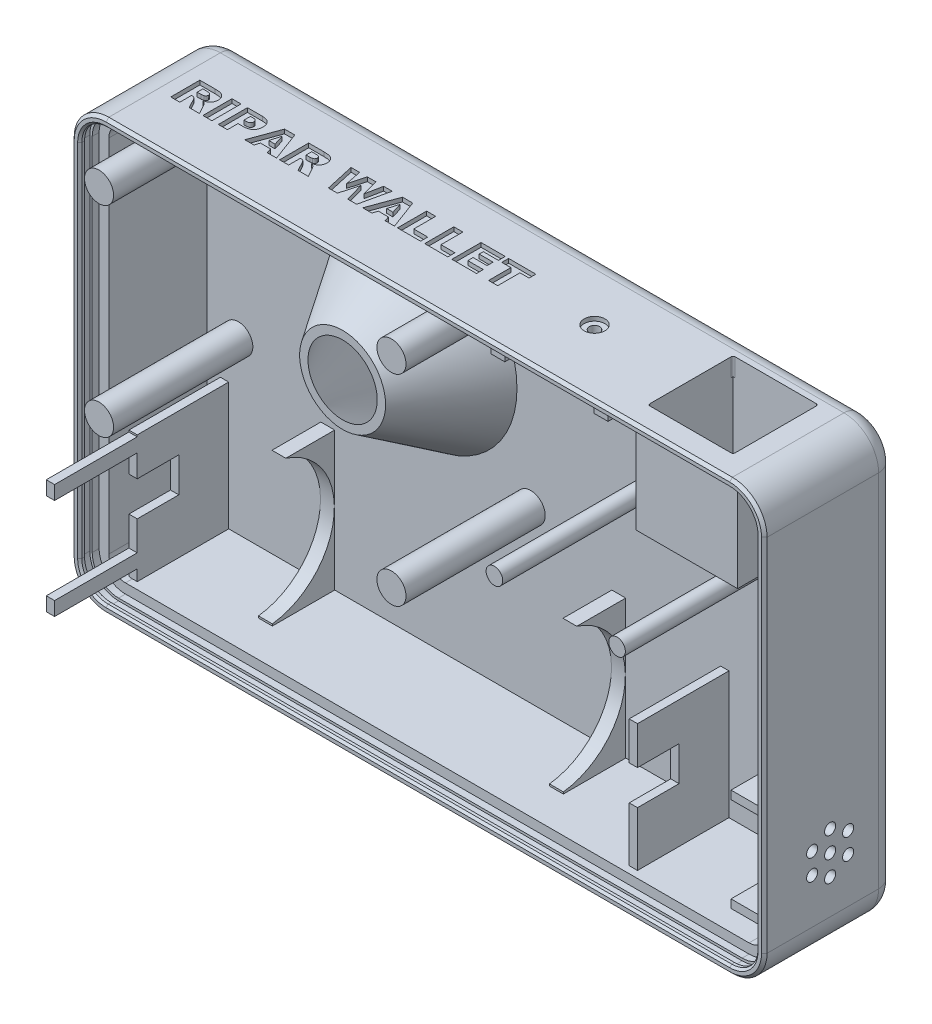
from build123d import *

# Parameters (mm, degrees)
BODY_DEPTH                 = 19
ROUND_BACK_R               = 2.5
CAVITY_DEPTH               = 17
REBATE_DEPTH               = 2.8
GROOVE_DEPTH               = 1.1
RIM_LEADIN_SIZE            = 0.3
SEAM_SHADOW_SIZE           = 0.4
BOARD_PEGS_SK5_R           = 2.1
BOARD_PEGS_DEPTH           = 20.1
CELL_SADDLES_SK6_W         = 2
CELL_SADDLES_SK6_H         = 20
CELL_SADDLES_DEPTH         = 9
CELL_STOPS_SK7_W           = 1.2
CELL_STOPS_SK7_H           = 18.35
CELL_STOPS_DEPTH           = 13.2
TP_KEEPERS_SK8_W           = 1.2
TP_KEEPERS_SK8_H           = 2
TP_KEEPERS_DEPTH           = 11.93
CELL_WIRE_SLOTS_SK9_W      = 3
CELL_WIRE_SLOTS_SK9_H      = 5
CELL_WIRE_SLOTS_DEPTH      = 6
CELL_CAVITY_SK10_R         = 10.15
CELL_CAVITY_DEPTH          = 71
LENS_HOOD_SK11_R           = 13.668187322
LENS_HOOD_DEPTH            = 11.5
LENS_HOOD_TAPER            = 33
LENS_BORE_SK12_R           = 13.767002508
LENS_BORE_DEPTH            = 13.51
LENS_BORE_TAPER            = 33
LENS_BEZEL_SK13_R          = 17
LENS_BEZEL_SK13_R_2        = 16
LENS_BEZEL_DEPTH           = 0.6
SWITCH_CRADLE_SK14_W       = 14.7
SWITCH_CRADLE_SK14_H       = 14.2
SWITCH_CRADLE_SK14_W_2     = 12.3
SWITCH_CRADLE_SK14_H_2     = 12.3
SWITCH_CRADLE_DEPTH        = 12.15
SWITCH_FLOOR_SK15_W        = 14.7
SWITCH_FLOOR_SK15_H        = 14.2
SWITCH_FLOOR_DEPTH         = 1.2
SWITCH_HOLE_DEPTH          = 2.8
MIC_RAILS_SK17_W           = 1.2
MIC_RAILS_SK17_H           = 14
MIC_RAILS_DEPTH            = 2
MIC_LIPS_SK18_W            = 1.2
MIC_LIPS_SK18_H            = 14
MIC_LIPS_DEPTH             = 0.85
MIC_HOLE_SK19_R            = 0.75
MIC_HOLE_DEPTH             = 2.8
MIC_CSK_SK20_R             = 1.5
MIC_CSK_DEPTH              = 0.6
BUZZER_CRADLE_BLOCK_SK21_W = 14.2
BUZZER_CRADLE_BLOCK_SK21_H = 14.8
BUZZER_CRADLE_BLOCK_DEPTH  = 5
BUZZER_POCKET_DEPTH        = 5.01
BUZZER_HOLES_SK23_R        = 0.8
BUZZER_HOLES_DEPTH         = 2.8
BUZZER_CHAMBER_SK24_R      = 5
BUZZER_CHAMBER_DEPTH       = 1.3
MAX_POSTS_SK25_R           = 1.2
MAX_POSTS_DEPTH            = 26.1
TXT_TOP_SK26_W             = 1.309090909
TXT_TOP_SK26_H             = 4.2
TXT_TOP_DEPTH              = 0.6
TXT_BOTTOM_SK27_W          = 1.714285714
TXT_BOTTOM_SK27_H          = 5.5
TXT_BOTTOM_DEPTH           = 0.6
TXT_BACK_SK28_W            = 1.87012987
TXT_BACK_SK28_H            = 6
TXT_BACK_DEPTH             = 0.8


with BuildPart() as part:
    # Body_Sk1 → Body (new body)
    with BuildSketch(Plane.XY.offset(-13)):
        with BuildLine():
            Line((-45, -31), (45, -31))
            ThreePointArc((45, -31), (48.535533906, -29.535533906), (50, -26))
            Line((50, -26), (50, 26))
            ThreePointArc((50, 26), (48.535533906, 29.535533906), (45, 31))
            Line((45, 31), (-45, 31))
            ThreePointArc((-45, 31), (-48.535533906, 29.535533906), (-50, 26))
            Line((-50, 26), (-50, -26))
            ThreePointArc((-50, -26), (-48.535533906, -29.535533906), (-45, -31))
        make_face()
    extrude(amount=-BODY_DEPTH)

    # Round_Back
    round_back_edges = [part.edges().sort_by_distance(p)[0] for p in [
        (48.535533906, -29.535533906, -32),
        (50, 0, -32),
        (48.535533906, 29.535533906, -32),
        (0, 31, -32),
        (-48.535533906, 29.535533906, -32),
        (-50, 0, -32),
        (-48.535533906, -29.535533906, -32),
        (0, -31, -32),
    ]]
    fillet(round_back_edges, radius=ROUND_BACK_R)

    # Cavity_Sk2 → Cavity (cut)
    with BuildSketch(Plane.XY.offset(-13)):
        with BuildLine():
            Line((-45, -28.4), (45, -28.4))
            ThreePointArc((45, -28.4), (46.697056275, -27.697056275), (47.4, -26))
            Line((47.4, -26), (47.4, 26))
            ThreePointArc((47.4, 26), (46.697056275, 27.697056275), (45, 28.4))
            Line((45, 28.4), (-45, 28.4))
            ThreePointArc((-45, 28.4), (-46.697056275, 27.697056275), (-47.4, 26))
            Line((-47.4, 26), (-47.4, -26))
            ThreePointArc((-47.4, -26), (-46.697056275, -27.697056275), (-45, -28.4))
        make_face()
    extrude(amount=-CAVITY_DEPTH, mode=Mode.SUBTRACT)

    # Rebate_Sk3 → Rebate (cut)
    with BuildSketch(Plane.XY.offset(-13)):
        with BuildLine():
            Line((-45, -29.8), (45, -29.8))
            ThreePointArc((45, -29.8), (47.687005769, -28.687005769), (48.8, -26))
            Line((48.8, -26), (48.8, 26))
            ThreePointArc((48.8, 26), (47.687005769, 28.687005769), (45, 29.8))
            Line((45, 29.8), (-45, 29.8))
            ThreePointArc((-45, 29.8), (-47.687005769, 28.687005769), (-48.8, 26))
            Line((-48.8, 26), (-48.8, -26))
            ThreePointArc((-48.8, -26), (-47.687005769, -28.687005769), (-45, -29.8))
        make_face()
        with BuildLine():
            Line((-45, -28.4), (45, -28.4))
            ThreePointArc((45, -28.4), (46.697056275, -27.697056275), (47.4, -26))
            Line((47.4, -26), (47.4, 26))
            ThreePointArc((47.4, 26), (46.697056275, 27.697056275), (45, 28.4))
            Line((45, 28.4), (-45, 28.4))
            ThreePointArc((-45, 28.4), (-46.697056275, 27.697056275), (-47.4, 26))
            Line((-47.4, 26), (-47.4, -26))
            ThreePointArc((-47.4, -26), (-46.697056275, -27.697056275), (-45, -28.4))
        make_face(mode=Mode.SUBTRACT)
    extrude(amount=-REBATE_DEPTH, mode=Mode.SUBTRACT)

    # Groove_Sk4 → Groove (cut)
    with BuildSketch(Plane.XY.offset(-13.7)):
        with BuildLine():
            Line((-45, -30.15), (45, -30.15))
            ThreePointArc((45, -30.15), (47.934493142, -28.934493142), (49.15, -26))
            Line((49.15, -26), (49.15, 26))
            ThreePointArc((49.15, 26), (47.934493142, 28.934493142), (45, 30.15))
            Line((45, 30.15), (-45, 30.15))
            ThreePointArc((-45, 30.15), (-47.934493142, 28.934493142), (-49.15, 26))
            Line((-49.15, 26), (-49.15, -26))
            ThreePointArc((-49.15, -26), (-47.934493142, -28.934493142), (-45, -30.15))
        make_face()
        with BuildLine():
            Line((-45, -29.5), (45, -29.5))
            ThreePointArc((45, -29.5), (47.474873734, -28.474873734), (48.5, -26))
            Line((48.5, -26), (48.5, 26))
            ThreePointArc((48.5, 26), (47.474873734, 28.474873734), (45, 29.5))
            Line((45, 29.5), (-45, 29.5))
            ThreePointArc((-45, 29.5), (-47.474873734, 28.474873734), (-48.5, 26))
            Line((-48.5, 26), (-48.5, -26))
            ThreePointArc((-48.5, -26), (-47.474873734, -28.474873734), (-45, -29.5))
        make_face(mode=Mode.SUBTRACT)
    extrude(amount=-GROOVE_DEPTH, mode=Mode.SUBTRACT)

    # Rim_LeadIn
    rim_leadin_edges = [part.edges().sort_by_distance(p)[0] for p in [
        (-47.687005769, -28.687005769, -13),
        (0, -29.8, -13),
        (47.687005769, -28.687005769, -13),
        (48.8, 0, -13),
        (47.687005769, 28.687005769, -13),
        (0, 29.8, -13),
        (-47.687005769, 28.687005769, -13),
        (-48.8, 0, -13),
    ]]
    chamfer(rim_leadin_edges, length=RIM_LEADIN_SIZE)

    # Seam_Shadow
    seam_shadow_edges = [part.edges().sort_by_distance(p)[0] for p in [
        (50, 0, -13),
        (48.535533906, -29.535533906, -13),
        (0, -31, -13),
        (-48.535533906, -29.535533906, -13),
        (-50, 0, -13),
        (-48.535533906, 29.535533906, -13),
        (0, 31, -13),
        (48.535533906, 29.535533906, -13),
    ]]
    chamfer(seam_shadow_edges, length=SEAM_SHADOW_SIZE)

    # Board_Pegs_Sk5 → Board_Pegs (add)
    with BuildSketch(Plane.XY.offset(-30)):
        with Locations(Location((-0.71, -3.91, 0), (0, 0, 180))):
            Circle(BOARD_PEGS_SK5_R)
        with Locations(Location((-0.71, 25.09, 0), (0, 0, 180))):
            Circle(BOARD_PEGS_SK5_R)
        with Locations(Location((-42.915, -3.91, 0), (0, 0, 180))):
            Circle(BOARD_PEGS_SK5_R)
        with Locations(Location((-42.915, 25.09, 0), (0, 0, 180))):
            Circle(BOARD_PEGS_SK5_R)
    extrude(amount=BOARD_PEGS_DEPTH)

    # Cell_Saddles_Sk6 → Cell_Saddles (add)
    with BuildSketch(Plane.XY.offset(-30)):
        with Locations((-30, -18.4)):
            Rectangle(CELL_SADDLES_SK6_W, CELL_SADDLES_SK6_H)
        with Locations((12, -18.4)):
            Rectangle(CELL_SADDLES_SK6_W, CELL_SADDLES_SK6_H)
    extrude(amount=CELL_SADDLES_DEPTH)

    # Cell_Stops_Sk7 → Cell_Stops (add)
    with BuildSketch(Plane.XY.offset(-30)):
        with Locations((-44.9, -19.225)):
            Rectangle(CELL_STOPS_SK7_W, CELL_STOPS_SK7_H)
        with Locations((27.3, -19.225)):
            Rectangle(CELL_STOPS_SK7_W, CELL_STOPS_SK7_H)
    extrude(amount=CELL_STOPS_DEPTH)

    # TP_Keepers_Sk8 → TP_Keepers (add)
    with BuildSketch(Plane.XY.offset(-16.8)):
        with Locations((-44.9, -25.8)):
            Rectangle(TP_KEEPERS_SK8_W, TP_KEEPERS_SK8_H)
        with Locations((-44.9, -11.3)):
            Rectangle(TP_KEEPERS_SK8_W, TP_KEEPERS_SK8_H)
    extrude(amount=TP_KEEPERS_DEPTH)

    # Cell_Wire_Slots_Sk9 → Cell_Wire_Slots (cut)
    with BuildSketch(Plane.XY.offset(-16.8)):
        with Locations((-44.9, -18.05)):
            Rectangle(CELL_WIRE_SLOTS_SK9_W, CELL_WIRE_SLOTS_SK9_H)
        with Locations((27.3, -18.05)):
            Rectangle(CELL_WIRE_SLOTS_SK9_W, CELL_WIRE_SLOTS_SK9_H)
    extrude(amount=-CELL_WIRE_SLOTS_DEPTH, mode=Mode.SUBTRACT)

    # Cell_Cavity_Sk10 → Cell_Cavity (cut)
    with BuildSketch(Plane(origin=(-44.3, 0, 0), x_dir=(0, 0, -1), z_dir=(1, 0, 0))):
        with Locations((19.8, -18.05)):
            Circle(CELL_CAVITY_SK10_R)
    extrude(amount=CELL_CAVITY_DEPTH, mode=Mode.SUBTRACT)

    # Lens_Hood_Sk11 → Lens_Hood (add)
    with BuildSketch(Plane.XY.offset(-30)):
        with Locations((-16.36, 9.94)):
            Circle(LENS_HOOD_SK11_R)
    extrude(amount=LENS_HOOD_DEPTH, taper=LENS_HOOD_TAPER)

    # Lens_Bore_Sk12 → Lens_Bore (cut)
    with BuildSketch(Plane.XY.offset(-32)):
        with Locations((-16.36, 9.94)):
            Circle(LENS_BORE_SK12_R)
    extrude(amount=LENS_BORE_DEPTH, taper=LENS_BORE_TAPER, mode=Mode.SUBTRACT)

    # Lens_Bezel_Sk13 → Lens_Bezel (cut)
    with BuildSketch(Plane.XY.offset(-32)):
        with Locations((-16.36, 9.94)):
            Circle(LENS_BEZEL_SK13_R)
        with Locations((-16.36, 9.94)):
            Circle(LENS_BEZEL_SK13_R_2, mode=Mode.SUBTRACT)
    extrude(amount=LENS_BEZEL_DEPTH, mode=Mode.SUBTRACT)

    # Switch_Cradle_Sk14 → Switch_Cradle (add)
    with BuildSketch(Plane(origin=(0, 28.4, 0), x_dir=(1, 0, 0), z_dir=(0, 1, 0))):
        with Locations((36, 22.9)):
            Rectangle(SWITCH_CRADLE_SK14_W, SWITCH_CRADLE_SK14_H)
        with Locations((36, 22.5)):
            Rectangle(SWITCH_CRADLE_SK14_W_2, SWITCH_CRADLE_SK14_H_2, mode=Mode.SUBTRACT)
    extrude(amount=-SWITCH_CRADLE_DEPTH)

    # Switch_Floor_Sk15 → Switch_Floor (add)
    with BuildSketch(Plane(origin=(0, 16.25, 0), x_dir=(1, 0, 0), z_dir=(0, 1, 0))):
        with Locations((36, 22.9)):
            Rectangle(SWITCH_FLOOR_SK15_W, SWITCH_FLOOR_SK15_H)
        with BuildLine():
            Line((31.25, 27.75), (40.75, 27.75))
            ThreePointArc((40.75, 27.75), (41.103553391, 27.603553391), (41.25, 27.25))
            Line((41.25, 27.25), (41.25, 17.75))
            ThreePointArc((41.25, 17.75), (41.103553391, 17.396446609), (40.75, 17.25))
            Line((40.75, 17.25), (31.25, 17.25))
            ThreePointArc((31.25, 17.25), (30.896446609, 17.396446609), (30.75, 17.75))
            Line((30.75, 17.75), (30.75, 27.25))
            ThreePointArc((30.75, 27.25), (30.896446609, 27.603553391), (31.25, 27.75))
        make_face(mode=Mode.SUBTRACT)
    extrude(amount=-SWITCH_FLOOR_DEPTH)

    # Switch_Hole_Sk16 → Switch_Hole (cut)
    with BuildSketch(Plane(origin=(0, 31, 0), x_dir=(1, 0, 0), z_dir=(0, 1, 0))):
        with BuildLine():
            Line((30.15, 28.65), (41.85, 28.65))
            ThreePointArc((41.85, 28.65), (42.062132034, 28.562132034), (42.15, 28.35))
            Line((42.15, 28.35), (42.15, 16.65))
            ThreePointArc((42.15, 16.65), (42.062132034, 16.437867966), (41.85, 16.35))
            Line((41.85, 16.35), (30.15, 16.35))
            ThreePointArc((30.15, 16.35), (29.937867966, 16.437867966), (29.85, 16.65))
            Line((29.85, 16.65), (29.85, 28.35))
            ThreePointArc((29.85, 28.35), (29.937867966, 28.562132034), (30.15, 28.65))
        make_face()
    extrude(amount=-SWITCH_HOLE_DEPTH, mode=Mode.SUBTRACT)

    # Mic_Rails_Sk17 → Mic_Rails (add)
    with BuildSketch(Plane(origin=(0, 28.4, 0), x_dir=(1, 0, 0), z_dir=(0, 1, 0))):
        with Locations((8.15, 23)):
            Rectangle(MIC_RAILS_SK17_W, MIC_RAILS_SK17_H)
        with Locations((23.85, 23)):
            Rectangle(MIC_RAILS_SK17_W, MIC_RAILS_SK17_H)
    extrude(amount=-MIC_RAILS_DEPTH)

    # Mic_Lips_Sk18 → Mic_Lips (add)
    with BuildSketch(Plane(origin=(0, 27.25, 0), x_dir=(1, 0, 0), z_dir=(0, 1, 0))):
        with Locations((8.95, 23)):
            Rectangle(MIC_LIPS_SK18_W, MIC_LIPS_SK18_H)
        with Locations((23.05, 23)):
            Rectangle(MIC_LIPS_SK18_W, MIC_LIPS_SK18_H)
    extrude(amount=-MIC_LIPS_DEPTH)

    # Mic_Hole_Sk19 → Mic_Hole (cut)
    with BuildSketch(Plane(origin=(0, 31, 0), x_dir=(1, 0, 0), z_dir=(0, 1, 0))):
        with Locations(Location((16, 22.5, 0), (0, 0, 270))):
            Circle(MIC_HOLE_SK19_R)
    extrude(amount=-MIC_HOLE_DEPTH, mode=Mode.SUBTRACT)

    # Mic_Csk_Sk20 → Mic_Csk (cut)
    with BuildSketch(Plane(origin=(0, 31, 0), x_dir=(1, 0, 0), z_dir=(0, 1, 0))):
        with Locations(Location((16, 22.5, 0), (0, 0, 270))):
            Circle(MIC_CSK_SK20_R)
    extrude(amount=-MIC_CSK_DEPTH, mode=Mode.SUBTRACT)

    # Buzzer_Cradle_Block_Sk21 → Buzzer_Cradle_Block (add)
    with BuildSketch(Plane(origin=(47.4, 0, 0), x_dir=(0, 0, -1), z_dir=(1, 0, 0))):
        with Locations((22.9, -18)):
            Rectangle(BUZZER_CRADLE_BLOCK_SK21_W, BUZZER_CRADLE_BLOCK_SK21_H)
    extrude(amount=-BUZZER_CRADLE_BLOCK_DEPTH)

    # Buzzer_Pocket_Sk22 → Buzzer_Pocket (cut)
    with BuildSketch(Plane(origin=(47.41, 0, 0), x_dir=(0, 0, -1), z_dir=(1, 0, 0))):
        with BuildLine():
            Line((13.5, -24.2), (22.5, -24.2))
            ThreePointArc((22.5, -24.2), (28.7, -18), (22.5, -11.8))
            Line((22.5, -11.8), (13.5, -11.8))
            Line((13.5, -11.8), (13.5, -24.2))
        make_face()
    extrude(amount=-BUZZER_POCKET_DEPTH, mode=Mode.SUBTRACT)

    # Buzzer_Holes_Sk23 → Buzzer_Holes (cut)
    with BuildSketch(Plane(origin=(50, 0, 0), x_dir=(0, 0, -1), z_dir=(1, 0, 0))):
        with Locations((22.5, -18)):
            Circle(BUZZER_HOLES_SK23_R)
        with Locations((22.5, -15)):
            Circle(BUZZER_HOLES_SK23_R)
        with Locations((19.901923789, -16.5)):
            Circle(BUZZER_HOLES_SK23_R)
        with Locations((19.901923789, -19.5)):
            Circle(BUZZER_HOLES_SK23_R)
        with Locations((22.5, -21)):
            Circle(BUZZER_HOLES_SK23_R)
        with Locations((25.098076211, -19.5)):
            Circle(BUZZER_HOLES_SK23_R)
        with Locations((25.098076211, -16.5)):
            Circle(BUZZER_HOLES_SK23_R)
    extrude(amount=-BUZZER_HOLES_DEPTH, mode=Mode.SUBTRACT)

    # Buzzer_Chamber_Sk24 → Buzzer_Chamber (cut)
    with BuildSketch(Plane(origin=(47.4, 0, 0), x_dir=(0, 0, -1), z_dir=(1, 0, 0))):
        with Locations((22.5, -18)):
            Circle(BUZZER_CHAMBER_SK24_R)
    extrude(amount=BUZZER_CHAMBER_DEPTH, mode=Mode.SUBTRACT)

    # MAX_Posts_Sk25 → MAX_Posts (add)
    with BuildSketch(Plane.XY.offset(-30)):
        with Locations((20.15, 11)):
            Circle(MAX_POSTS_SK25_R)
        with Locations((37.85, 11)):
            Circle(MAX_POSTS_SK25_R)
    extrude(amount=MAX_POSTS_DEPTH)

    # Txt_Top_Sk26 → Txt_Top (cut)
    # profile 1 of 11: a face of its own
    with BuildSketch(Plane(origin=(0, 31, 0), x_dir=(1, 0, 0), z_dir=(0, 1, 0))):
        with BuildLine():
            Line((-43.063636364, 20.4), (-43.063636364, 24.6))
            Line((-43.063636364, 24.6), (-40.884375, 24.6))
            add(Edge.make_bspline(
                [(-40.884375, 24.6), (-40.835221519, 24.59971639), (-40.740011441, 24.599167039), (-40.601919347, 24.593720803), (-40.472869492, 24.586360804), (-40.352532912, 24.57571362), (-40.241173106, 24.560145388), (-40.138829186, 24.542330308), (-40.045197391, 24.52254548), (-39.96007143, 24.497117462), (-39.88045143, 24.469318863), (-39.805945745, 24.435124965), (-39.73581699, 24.394306162), (-39.668531202, 24.349879627), (-39.60579359, 24.298760032), (-39.5467318, 24.2426364), (-39.49242178, 24.179893259), (-39.44130358, 24.113005035), (-39.395101153, 24.041348631), (-39.355041252, 23.96516429), (-39.320733022, 23.885182272), (-39.29397553, 23.801040128), (-39.271167754, 23.713889004), (-39.256032978, 23.622327282), (-39.247800087, 23.526857352), (-39.246244614, 23.461947046), (-39.245454545, 23.428977273)],
                knots=[0, 0, 0, 0, 1.530161939, 2.963916964, 4.301772633, 5.554104584, 6.723590755, 7.801032641, 8.78815049, 9.700526589, 10.564961228, 11.411843923, 12.247756654, 13.089125762, 13.919263632, 14.763741457, 15.622365315, 16.499733513, 17.382922017, 18.273079804, 19.176582198, 20.088357964, 21.01932039, 21.978954871, 22.973454249, 24, 24, 24, 24], degree=3))
            add(Edge.make_bspline(
                [(-39.245454545, 23.428977273), (-39.247073208, 23.372591064), (-39.250227218, 23.262720891), (-39.279947421, 23.104227876), (-39.327520899, 22.957031296), (-39.395508901, 22.822901534), (-39.479851155, 22.700983267), (-39.578759049, 22.591190435), (-39.691814619, 22.492640875), (-39.77679289, 22.438711734), (-39.819886364, 22.411363636)],
                knots=[0, 0, 0, 0, 1.101993432, 2.147266335, 3.141901439, 4.118584363, 5.077365473, 6.033582582, 7.002806774, 8, 8, 8, 8], degree=3))
            add(Edge.make_bspline(
                [(-39.819886364, 22.411363636), (-39.850581905, 22.394892427), (-39.915884444, 22.359851123), (-40.025609091, 22.316248363), (-40.151246892, 22.277548828), (-40.240777869, 22.255758633), (-40.287784091, 22.244318182)],
                knots=[0, 0, 0, 0, 0.837915425, 1.782604315, 2.835806388, 4, 4, 4, 4], degree=3))
            add(Edge.make_bspline(
                [(-40.287784091, 22.244318182), (-40.251832385, 22.231658258), (-40.184663787, 22.208005713), (-40.092812099, 22.168861645), (-40.016471383, 22.129493898), (-39.972789612, 22.100080372), (-39.952840909, 22.086647727)],
                knots=[0, 0, 0, 0, 1.231012792, 2.299902127, 3.223594947, 4, 4, 4, 4], degree=3))
            add(Edge.make_bspline(
                [(-39.952840909, 22.086647727), (-39.939565416, 22.075796548), (-39.908700181, 22.050567791), (-39.861729187, 22.001156793), (-39.806648361, 21.937174458), (-39.746963417, 21.862245826), (-39.68757278, 21.785660348), (-39.636457776, 21.714465941), (-39.596491976, 21.653218147), (-39.575915633, 21.614616694), (-39.566761364, 21.597443182)],
                knots=[0, 0, 0, 0, 0.656872418, 1.527214186, 2.608218659, 3.894218048, 5.199173982, 6.323536816, 7.254153438, 8, 8, 8, 8], degree=3))
            Line((-39.566761364, 21.597443182), (-38.918181818, 20.4))
            Line((-38.918181818, 20.4), (-40.395170455, 20.4))
            Line((-40.395170455, 20.4), (-41.085511364, 21.673295455))
            add(Edge.make_bspline(
                [(-41.085511364, 21.673295455), (-41.106256099, 21.71114547), (-41.144547401, 21.781010253), (-41.205224007, 21.87234537), (-41.260630898, 21.944610116), (-41.302279492, 21.979249633), (-41.320738636, 21.994602273)],
                knots=[0, 0, 0, 0, 1.29093653, 2.38285239, 3.283261246, 4, 4, 4, 4], degree=3))
            add(Edge.make_bspline(
                [(-41.320738636, 21.994602273), (-41.344494941, 22.009270374), (-41.391947009, 22.038569195), (-41.470228028, 22.069123437), (-41.553390351, 22.087667577), (-41.61041288, 22.089814418), (-41.639488636, 22.090909091)],
                knots=[0, 0, 0, 0, 0.98982165, 1.977120801, 2.968535002, 4, 4, 4, 4], degree=3))
            Line((-41.639488636, 22.090909091), (-41.754545455, 22.090909091))
            Line((-41.754545455, 22.090909091), (-41.754545455, 20.4))
            Line((-41.754545455, 20.4), (-43.063636364, 20.4))
        make_face()
        with BuildLine():
            Line((-41.754545455, 22.909090909), (-41.199715909, 22.909090909))
            add(Edge.make_bspline(
                [(-41.199715909, 22.909090909), (-41.181226216, 22.909966234), (-41.136957612, 22.912061964), (-41.060263363, 22.923576393), (-40.962497763, 22.94049139), (-40.890581174, 22.955438289), (-40.851136364, 22.963636364)],
                knots=[0, 0, 0, 0, 0.628542805, 1.504876911, 2.631474917, 4, 4, 4, 4], degree=3))
            add(Edge.make_bspline(
                [(-40.851136364, 22.963636364), (-40.830135956, 22.968534503), (-40.788534834, 22.978237556), (-40.731410221, 23.006309554), (-40.679644997, 23.042629926), (-40.635818857, 23.08865507), (-40.600142794, 23.141537496), (-40.573375918, 23.198618343), (-40.5573147, 23.259932111), (-40.555480812, 23.301893457), (-40.554545455, 23.323295455)],
                knots=[0, 0, 0, 0, 1.020158048, 2.02089986, 2.99701443, 4.007421106, 5.016748479, 6.011755855, 6.985914375, 8, 8, 8, 8], degree=3))
            add(Edge.make_bspline(
                [(-40.554545455, 23.323295455), (-40.556166489, 23.354124324), (-40.559253417, 23.41283158), (-40.583108938, 23.496113887), (-40.626449586, 23.566543737), (-40.674806347, 23.615956096), (-40.722373965, 23.649064342), (-40.766483661, 23.67011424), (-40.81747843, 23.687610036), (-40.875700716, 23.702006225), (-40.940532382, 23.714036947), (-41.012956461, 23.720990899), (-41.092245051, 23.726504066), (-41.147715378, 23.727008899), (-41.176704545, 23.727272727)],
                knots=[0, 0, 0, 0, 1.307875681, 2.490580844, 3.632121613, 4.783239074, 5.398689137, 6.08357963, 6.850117088, 7.683629419, 8.627346907, 9.646048077, 10.76980885, 12, 12, 12, 12], degree=3))
            Line((-41.176704545, 23.727272727), (-41.754545455, 23.727272727))
            Line((-41.754545455, 23.727272727), (-41.754545455, 22.909090909))
        make_face(mode=Mode.SUBTRACT)
    # profile 2 of 11: a face of its own
    with BuildSketch(Plane(origin=(0, 31, 0), x_dir=(1, 0, 0), z_dir=(0, 1, 0))):
        with Locations((-37.772727273, 22.5)):
            Rectangle(TXT_TOP_SK26_W, TXT_TOP_SK26_H)
    # profile 3 of 11: a face of its own
    with BuildSketch(Plane(origin=(0, 31, 0), x_dir=(1, 0, 0), z_dir=(0, 1, 0))):
        with BuildLine():
            Line((-36.190909091, 24.6), (-34.044886364, 24.6))
            add(Edge.make_bspline(
                [(-34.044886364, 24.6), (-33.988310973, 24.599148604), (-33.878322334, 24.597493398), (-33.719070297, 24.581020382), (-33.570598986, 24.554741379), (-33.433024274, 24.518808526), (-33.306515769, 24.470675941), (-33.191077833, 24.412178028), (-33.086923126, 24.342300919), (-32.993266201, 24.262889438), (-32.91136929, 24.172835622), (-32.839953132, 24.073866004), (-32.779417433, 23.96607674), (-32.729429179, 23.849368713), (-32.692436782, 23.723014815), (-32.665561444, 23.588116352), (-32.647718315, 23.444507435), (-32.646221939, 23.345794099), (-32.645454545, 23.295170455)],
                knots=[0, 0, 0, 0, 1.241515469, 2.413639488, 3.509639858, 4.548817243, 5.52976409, 6.475202948, 7.383211966, 8.276715391, 9.16390762, 10.048312173, 10.950197757, 11.872189062, 12.829054998, 13.834337622, 14.889372722, 16, 16, 16, 16], degree=3))
            add(Edge.make_bspline(
                [(-32.645454545, 23.295170455), (-32.646494823, 23.242835005), (-32.648519654, 23.140967485), (-32.667271764, 22.992818048), (-32.695086311, 22.853145537), (-32.737935009, 22.722820737), (-32.789884584, 22.600026469), (-32.856583235, 22.487192798), (-32.9332349, 22.382257181), (-33.022778846, 22.287300579), (-33.12342841, 22.201157765), (-33.23816983, 22.127742446), (-33.364979888, 22.065646045), (-33.503709402, 22.014376583), (-33.65511866, 21.975406563), (-33.818782788, 21.947880726), (-33.99480302, 21.930603077), (-34.116151687, 21.928405387), (-34.178693182, 21.927272727)],
                knots=[0, 0, 0, 0, 1.070678102, 2.0840047, 3.052199674, 3.98082326, 4.887114164, 5.775697953, 6.657233547, 7.54169838, 8.441079866, 9.362025723, 10.321591586, 11.326104587, 12.383868031, 13.516659844, 14.720119404, 16, 16, 16, 16], degree=3))
            Line((-34.178693182, 21.927272727), (-34.881818182, 21.927272727))
            Line((-34.881818182, 21.927272727), (-34.881818182, 20.4))
            Line((-34.881818182, 20.4), (-36.190909091, 20.4))
            Line((-36.190909091, 20.4), (-36.190909091, 24.6))
        make_face()
        with BuildLine():
            Line((-34.881818182, 22.8), (-34.586079545, 22.8))
            add(Edge.make_bspline(
                [(-34.586079545, 22.8), (-34.557942888, 22.800233895), (-34.50387213, 22.800683376), (-34.426157716, 22.806666728), (-34.35491184, 22.81666804), (-34.290303797, 22.831194239), (-34.231840471, 22.848645504), (-34.180092796, 22.870991842), (-34.134749132, 22.897194386), (-34.083703822, 22.937072053), (-34.031628381, 22.99503796), (-33.986428155, 23.075027429), (-33.958749811, 23.164408623), (-33.955975629, 23.227070764), (-33.954545455, 23.259375)],
                knots=[0, 0, 0, 0, 1.140602214, 2.191917338, 3.157925331, 4.054994258, 4.874779576, 5.628012439, 6.335275679, 6.991953112, 8.247986947, 9.465288326, 10.693279177, 12, 12, 12, 12], degree=3))
            add(Edge.make_bspline(
                [(-33.954545455, 23.259375), (-33.955887688, 23.291067589), (-33.958489984, 23.352512572), (-33.982587738, 23.440716897), (-34.021356764, 23.521210639), (-34.066511246, 23.581498991), (-34.110880853, 23.625046227), (-34.153092379, 23.652002347), (-34.20054641, 23.676149133), (-34.255546343, 23.694468913), (-34.316402943, 23.710057058), (-34.384725598, 23.71948655), (-34.459212338, 23.726896215), (-34.511341407, 23.727144222), (-34.538352273, 23.727272727)],
                knots=[0, 0, 0, 0, 1.331134553, 2.580778166, 3.815700635, 5.070763247, 5.730238369, 6.419791528, 7.168166279, 7.965798043, 8.852899023, 9.808015955, 10.864215547, 12, 12, 12, 12], degree=3))
            Line((-34.538352273, 23.727272727), (-34.881818182, 23.727272727))
            Line((-34.881818182, 23.727272727), (-34.881818182, 22.8))
        make_face(mode=Mode.SUBTRACT)
    # profile 4 of 11: a face of its own
    with BuildSketch(Plane(origin=(0, 31, 0), x_dir=(1, 0, 0), z_dir=(0, 1, 0))):
        Polygon((-29.368465909, 21.109090909), (-30.830965909, 21.109090909), (-31.043181818, 20.4), (-32.372727273, 20.4), (-30.833522727, 24.6), (-29.356534091, 24.6), (-27.790909091, 20.4), (-29.15625, 20.4), align=None)
        Polygon((-29.646306818, 22.036363636), (-30.109090909, 23.526136364), (-30.553977273, 22.036363636), align=None, mode=Mode.SUBTRACT)
    # profile 5 of 11: a face of its own
    with BuildSketch(Plane(origin=(0, 31, 0), x_dir=(1, 0, 0), z_dir=(0, 1, 0))):
        with BuildLine():
            Line((-27.354545455, 20.4), (-27.354545455, 24.6))
            Line((-27.354545455, 24.6), (-25.175284091, 24.6))
            add(Edge.make_bspline(
                [(-25.175284091, 24.6), (-25.12613061, 24.59971639), (-25.030920532, 24.599167039), (-24.892828438, 24.593720803), (-24.763778583, 24.586360804), (-24.643442003, 24.57571362), (-24.532082197, 24.560145388), (-24.429738277, 24.542330308), (-24.336106482, 24.52254548), (-24.250980521, 24.497117462), (-24.171360521, 24.469318863), (-24.096854835, 24.435124965), (-24.026726081, 24.394306162), (-23.959440293, 24.349879627), (-23.896702681, 24.298760032), (-23.837640891, 24.2426364), (-23.783330871, 24.179893259), (-23.732212671, 24.113005035), (-23.686010244, 24.041348631), (-23.645950343, 23.96516429), (-23.611642112, 23.885182272), (-23.584884621, 23.801040128), (-23.562076845, 23.713889004), (-23.546942069, 23.622327282), (-23.538709178, 23.526857352), (-23.537153705, 23.461947046), (-23.536363636, 23.428977273)],
                knots=[0, 0, 0, 0, 1.530161939, 2.963916964, 4.301772633, 5.554104584, 6.723590755, 7.801032641, 8.78815049, 9.700526589, 10.564961228, 11.411843923, 12.247756654, 13.089125762, 13.919263632, 14.763741457, 15.622365315, 16.499733513, 17.382922017, 18.273079804, 19.176582198, 20.088357964, 21.01932039, 21.978954871, 22.973454249, 24, 24, 24, 24], degree=3))
            add(Edge.make_bspline(
                [(-23.536363636, 23.428977273), (-23.537982299, 23.372591064), (-23.541136309, 23.262720891), (-23.570856511, 23.104227876), (-23.61842999, 22.957031296), (-23.686417992, 22.822901534), (-23.770760245, 22.700983267), (-23.86966814, 22.591190435), (-23.98272371, 22.492640875), (-24.067701981, 22.438711734), (-24.110795455, 22.411363636)],
                knots=[0, 0, 0, 0, 1.101993432, 2.147266335, 3.141901439, 4.118584363, 5.077365473, 6.033582582, 7.002806774, 8, 8, 8, 8], degree=3))
            add(Edge.make_bspline(
                [(-24.110795455, 22.411363636), (-24.141490996, 22.394892427), (-24.206793535, 22.359851123), (-24.316518182, 22.316248363), (-24.442155983, 22.277548828), (-24.53168696, 22.255758633), (-24.578693182, 22.244318182)],
                knots=[0, 0, 0, 0, 0.837915425, 1.782604315, 2.835806388, 4, 4, 4, 4], degree=3))
            add(Edge.make_bspline(
                [(-24.578693182, 22.244318182), (-24.542741476, 22.231658258), (-24.475572877, 22.208005713), (-24.38372119, 22.168861645), (-24.307380474, 22.129493898), (-24.263698703, 22.100080372), (-24.24375, 22.086647727)],
                knots=[0, 0, 0, 0, 1.231012792, 2.299902127, 3.223594947, 4, 4, 4, 4], degree=3))
            add(Edge.make_bspline(
                [(-24.24375, 22.086647727), (-24.230474507, 22.075796548), (-24.199609272, 22.050567791), (-24.152638278, 22.001156793), (-24.097557452, 21.937174458), (-24.037872508, 21.862245826), (-23.978481871, 21.785660348), (-23.927366867, 21.714465941), (-23.887401067, 21.653218147), (-23.866824724, 21.614616694), (-23.857670455, 21.597443182)],
                knots=[0, 0, 0, 0, 0.656872418, 1.527214186, 2.608218659, 3.894218048, 5.199173982, 6.323536816, 7.254153438, 8, 8, 8, 8], degree=3))
            Line((-23.857670455, 21.597443182), (-23.209090909, 20.4))
            Line((-23.209090909, 20.4), (-24.686079545, 20.4))
            Line((-24.686079545, 20.4), (-25.376420455, 21.673295455))
            add(Edge.make_bspline(
                [(-25.376420455, 21.673295455), (-25.39716519, 21.71114547), (-25.435456492, 21.781010253), (-25.496133098, 21.87234537), (-25.551539989, 21.944610116), (-25.593188583, 21.979249633), (-25.611647727, 21.994602273)],
                knots=[0, 0, 0, 0, 1.29093653, 2.38285239, 3.283261246, 4, 4, 4, 4], degree=3))
            add(Edge.make_bspline(
                [(-25.611647727, 21.994602273), (-25.635404032, 22.009270374), (-25.6828561, 22.038569195), (-25.761137119, 22.069123437), (-25.844299442, 22.087667577), (-25.901321971, 22.089814418), (-25.930397727, 22.090909091)],
                knots=[0, 0, 0, 0, 0.98982165, 1.977120801, 2.968535002, 4, 4, 4, 4], degree=3))
            Line((-25.930397727, 22.090909091), (-26.045454545, 22.090909091))
            Line((-26.045454545, 22.090909091), (-26.045454545, 20.4))
            Line((-26.045454545, 20.4), (-27.354545455, 20.4))
        make_face()
        with BuildLine():
            Line((-26.045454545, 22.909090909), (-25.490625, 22.909090909))
            add(Edge.make_bspline(
                [(-25.490625, 22.909090909), (-25.472135307, 22.909966234), (-25.427866703, 22.912061964), (-25.351172454, 22.923576393), (-25.253406854, 22.94049139), (-25.181490265, 22.955438289), (-25.142045455, 22.963636364)],
                knots=[0, 0, 0, 0, 0.628542805, 1.504876911, 2.631474917, 4, 4, 4, 4], degree=3))
            add(Edge.make_bspline(
                [(-25.142045455, 22.963636364), (-25.121045047, 22.968534503), (-25.079443925, 22.978237556), (-25.022319312, 23.006309554), (-24.970554088, 23.042629926), (-24.926727948, 23.08865507), (-24.891051885, 23.141537496), (-24.864285009, 23.198618343), (-24.848223791, 23.259932111), (-24.846389903, 23.301893457), (-24.845454545, 23.323295455)],
                knots=[0, 0, 0, 0, 1.020158048, 2.02089986, 2.99701443, 4.007421106, 5.016748479, 6.011755855, 6.985914375, 8, 8, 8, 8], degree=3))
            add(Edge.make_bspline(
                [(-24.845454545, 23.323295455), (-24.84707558, 23.354124324), (-24.850162508, 23.41283158), (-24.874018029, 23.496113887), (-24.917358677, 23.566543737), (-24.965715438, 23.615956096), (-25.013283056, 23.649064342), (-25.057392751, 23.67011424), (-25.108387521, 23.687610036), (-25.166609807, 23.702006225), (-25.231441473, 23.714036947), (-25.303865552, 23.720990899), (-25.383154142, 23.726504066), (-25.438624469, 23.727008899), (-25.467613636, 23.727272727)],
                knots=[0, 0, 0, 0, 1.307875681, 2.490580844, 3.632121613, 4.783239074, 5.398689137, 6.08357963, 6.850117088, 7.683629419, 8.627346907, 9.646048077, 10.76980885, 12, 12, 12, 12], degree=3))
            Line((-25.467613636, 23.727272727), (-26.045454545, 23.727272727))
            Line((-26.045454545, 23.727272727), (-26.045454545, 22.909090909))
        make_face(mode=Mode.SUBTRACT)
    # profile 6 of 11: a face of its own
    with BuildSketch(Plane(origin=(0, 31, 0), x_dir=(1, 0, 0), z_dir=(0, 1, 0))):
        Polygon((-21.245454545, 24.6), (-20.007102273, 24.6), (-19.539204545, 22.269034091), (-18.886363636, 24.6), (-17.660795455, 24.6), (-17.000284091, 22.255397727), (-16.532386364, 24.6), (-15.3, 24.6), (-16.2375, 20.4), (-17.526988636, 20.4), (-18.272727273, 23.044602273), (-19.014204545, 20.4), (-20.301136364, 20.4), align=None)
    # profile 7 of 11: a face of its own
    with BuildSketch(Plane(origin=(0, 31, 0), x_dir=(1, 0, 0), z_dir=(0, 1, 0))):
        Polygon((-12.350284091, 21.109090909), (-13.812784091, 21.109090909), (-14.025, 20.4), (-15.354545455, 20.4), (-13.815340909, 24.6), (-12.338352273, 24.6), (-10.772727273, 20.4), (-12.138068182, 20.4), align=None)
        Polygon((-12.628125, 22.036363636), (-13.090909091, 23.526136364), (-13.535795455, 22.036363636), align=None, mode=Mode.SUBTRACT)
    # profile 8 of 11: a face of its own
    with BuildSketch(Plane(origin=(0, 31, 0), x_dir=(1, 0, 0), z_dir=(0, 1, 0))):
        Polygon((-10.336363636, 24.6), (-9.027272727, 24.6), (-9.027272727, 21.436363636), (-7.009090909, 21.436363636), (-7.009090909, 20.4), (-10.336363636, 20.4), align=None)
    # profile 9 of 11: a face of its own
    with BuildSketch(Plane(origin=(0, 31, 0), x_dir=(1, 0, 0), z_dir=(0, 1, 0))):
        Polygon((-6.409090909, 24.6), (-5.1, 24.6), (-5.1, 21.436363636), (-3.081818182, 21.436363636), (-3.081818182, 20.4), (-6.409090909, 20.4), align=None)
    # profile 10 of 11: a face of its own
    with BuildSketch(Plane(origin=(0, 31, 0), x_dir=(1, 0, 0), z_dir=(0, 1, 0))):
        Polygon((-2.481818182, 24.6), (1.009090909, 24.6), (1.009090909, 23.618181818), (-1.172727273, 23.618181818), (-1.172727273, 23.018181818), (0.845454545, 23.018181818), (0.845454545, 22.145454545), (-1.172727273, 22.145454545), (-1.172727273, 21.381818182), (1.063636364, 21.381818182), (1.063636364, 20.4), (-2.481818182, 20.4), align=None)
    # profile 11 of 11: a face of its own
    with BuildSketch(Plane(origin=(0, 31, 0), x_dir=(1, 0, 0), z_dir=(0, 1, 0))):
        Polygon((1.5, 24.6), (5.427272727, 24.6), (5.427272727, 23.618181818), (4.118181818, 23.618181818), (4.118181818, 20.4), (2.809090909, 20.4), (2.809090909, 23.618181818), (1.5, 23.618181818), align=None)
    extrude(amount=-TXT_TOP_DEPTH, mode=Mode.SUBTRACT)

    # Txt_Bottom_Sk27 → Txt_Bottom (cut)
    # profile 1 of 11: a face of its own
    with BuildSketch(Plane(origin=(0, -31, 0), x_dir=(1, 0, 0), z_dir=(0, 1, 0))):
        with BuildLine():
            Line((31.178571429, 19.75), (31.178571429, 25.25))
            Line((31.178571429, 25.25), (28.324776786, 25.25))
            add(Edge.make_bspline(
                [(28.324776786, 25.25), (28.260409132, 25.249628606), (28.135729269, 25.248909217), (27.954894383, 25.241777243), (27.785900525, 25.232139148), (27.628316909, 25.218196407), (27.482488591, 25.197809437), (27.348466791, 25.174480166), (27.225853726, 25.148571462), (27.114379253, 25.115272867), (27.010114968, 25.078869939), (26.912547999, 25.034092217), (26.820712725, 24.980639022), (26.732600384, 24.922461416), (26.650443987, 24.855519089), (26.573101166, 24.782023857), (26.501980902, 24.69986022), (26.435040403, 24.612268499), (26.374537225, 24.518432732), (26.32207783, 24.418667522), (26.277150385, 24.313929166), (26.242110814, 24.203743025), (26.212243488, 24.089616552), (26.192424138, 23.969714298), (26.181642972, 23.844694151), (26.179606042, 23.75969256), (26.178571429, 23.716517857)],
                knots=[0, 0, 0, 0, 1.530161939, 2.963916964, 4.301772633, 5.554104584, 6.723590755, 7.801032641, 8.78815049, 9.700526589, 10.564961228, 11.411843923, 12.247756654, 13.089125762, 13.919263632, 14.763741457, 15.622365315, 16.499733513, 17.382922017, 18.273079804, 19.176582198, 20.088357964, 21.01932039, 21.978954871, 22.973454249, 24, 24, 24, 24], degree=3))
            add(Edge.make_bspline(
                [(26.178571429, 23.716517857), (26.180691105, 23.642678774), (26.184821357, 23.498801167), (26.22374067, 23.29125079), (26.286039273, 23.098493364), (26.37507118, 22.922847248), (26.485519369, 22.763192374), (26.615041612, 22.619416046), (26.763090573, 22.490363051), (26.874371642, 22.419741556), (26.930803571, 22.383928571)],
                knots=[0, 0, 0, 0, 1.101993432, 2.147266335, 3.141901439, 4.118584363, 5.077365473, 6.033582582, 7.002806774, 8, 8, 8, 8], degree=3))
            add(Edge.make_bspline(
                [(26.930803571, 22.383928571), (26.971000114, 22.362359131), (27.056515343, 22.316471709), (27.200202381, 22.259372856), (27.364728072, 22.208694894), (27.48197102, 22.180160114), (27.543526786, 22.165178571)],
                knots=[0, 0, 0, 0, 0.837915425, 1.782604315, 2.835806388, 4, 4, 4, 4], degree=3))
            add(Edge.make_bspline(
                [(27.543526786, 22.165178571), (27.496447171, 22.1486001), (27.408488292, 22.117626529), (27.28820632, 22.06636644), (27.188236335, 22.014813438), (27.131034016, 21.976295725), (27.104910714, 21.958705357)],
                knots=[0, 0, 0, 0, 1.231012792, 2.299902127, 3.223594947, 4, 4, 4, 4], degree=3))
            add(Edge.make_bspline(
                [(27.104910714, 21.958705357), (27.08752614, 21.94449548), (27.04710738, 21.911457821), (26.985597745, 21.846752943), (26.913468092, 21.762966552), (26.835309237, 21.664845724), (26.757535784, 21.564555218), (26.690599469, 21.471324447), (26.638263302, 21.391119002), (26.61131809, 21.34056948), (26.599330357, 21.318080357)],
                knots=[0, 0, 0, 0, 0.656872418, 1.527214186, 2.608218659, 3.894218048, 5.199173982, 6.323536816, 7.254153438, 8, 8, 8, 8], degree=3))
            Line((26.599330357, 21.318080357), (25.75, 19.75))
            Line((25.75, 19.75), (27.684151786, 19.75))
            Line((27.684151786, 19.75), (28.588169643, 21.417410714))
            add(Edge.make_bspline(
                [(28.588169643, 21.417410714), (28.615335367, 21.466976211), (28.66547874, 21.558465807), (28.744936199, 21.678071318), (28.817492843, 21.772703723), (28.872032668, 21.818064996), (28.896205357, 21.838169643)],
                knots=[0, 0, 0, 0, 1.29093653, 2.38285239, 3.283261246, 4, 4, 4, 4], degree=3))
            add(Edge.make_bspline(
                [(28.896205357, 21.838169643), (28.927314804, 21.857377871), (28.989454417, 21.895745375), (29.091965275, 21.935756881), (29.200868317, 21.960040875), (29.275540676, 21.962852214), (29.313616071, 21.964285714)],
                knots=[0, 0, 0, 0, 0.98982165, 1.977120801, 2.968535002, 4, 4, 4, 4], degree=3))
            Line((29.313616071, 21.964285714), (29.464285714, 21.964285714))
            Line((29.464285714, 21.964285714), (29.464285714, 19.75))
            Line((29.464285714, 19.75), (31.178571429, 19.75))
        make_face()
        with BuildLine():
            Line((29.464285714, 23.035714286), (28.737723214, 23.035714286))
            add(Edge.make_bspline(
                [(28.737723214, 23.035714286), (28.713510521, 23.036860544), (28.65553973, 23.039604953), (28.555106785, 23.054683372), (28.427080405, 23.076833963), (28.332903918, 23.096407283), (28.28125, 23.107142857)],
                knots=[0, 0, 0, 0, 0.628542805, 1.504876911, 2.631474917, 4, 4, 4, 4], degree=3))
            add(Edge.make_bspline(
                [(28.28125, 23.107142857), (28.253749467, 23.113557087), (28.199271807, 23.126263467), (28.124465766, 23.163024417), (28.056677972, 23.210586807), (27.999286599, 23.27085783), (27.952567945, 23.340108626), (27.917516084, 23.414857354), (27.896483535, 23.495149193), (27.894082016, 23.550098574), (27.892857143, 23.578125)],
                knots=[0, 0, 0, 0, 1.020158048, 2.02089986, 2.99701443, 4.007421106, 5.016748479, 6.011755855, 6.985914375, 8, 8, 8, 8], degree=3))
            add(Edge.make_bspline(
                [(27.892857143, 23.578125), (27.894979926, 23.618496139), (27.899022332, 23.695374687), (27.930261705, 23.804434852), (27.987017315, 23.896664418), (28.050341645, 23.961371078), (28.112632574, 24.004727115), (28.17039527, 24.032292457), (28.237174134, 24.055203619), (28.313417605, 24.07405577), (28.398316214, 24.089810288), (28.49315727, 24.098916654), (28.596987567, 24.106136277), (28.669627281, 24.106797367), (28.707589286, 24.107142857)],
                knots=[0, 0, 0, 0, 1.307875681, 2.490580844, 3.632121613, 4.783239074, 5.398689137, 6.08357963, 6.850117088, 7.683629419, 8.627346907, 9.646048077, 10.76980885, 12, 12, 12, 12], degree=3))
            Line((28.707589286, 24.107142857), (29.464285714, 24.107142857))
            Line((29.464285714, 24.107142857), (29.464285714, 23.035714286))
        make_face(mode=Mode.SUBTRACT)
    # profile 2 of 11: a face of its own
    with BuildSketch(Plane(origin=(0, -31, 0), x_dir=(1, 0, 0), z_dir=(0, 1, 0))):
        with Locations((24.25, 22.5)):
            Rectangle(TXT_BOTTOM_SK27_W, TXT_BOTTOM_SK27_H)
    # profile 3 of 11: a face of its own
    with BuildSketch(Plane(origin=(0, -31, 0), x_dir=(1, 0, 0), z_dir=(0, 1, 0))):
        with BuildLine():
            Line((22.178571429, 25.25), (19.368303571, 25.25))
            add(Edge.make_bspline(
                [(19.368303571, 25.25), (19.29421675, 25.248885076), (19.150184009, 25.246717545), (18.941639675, 25.225145738), (18.747212958, 25.190732759), (18.567055597, 25.143677832), (18.401389698, 25.080647066), (18.250220972, 25.004042655), (18.113827903, 24.912536918), (17.991181929, 24.808545693), (17.883935975, 24.690618076), (17.790414816, 24.561015005), (17.711141877, 24.419862398), (17.645681068, 24.267030457), (17.597238643, 24.101567019), (17.562044748, 23.924914271), (17.538678746, 23.736854974), (17.536719206, 23.607587511), (17.535714286, 23.541294643)],
                knots=[0, 0, 0, 0, 1.241515469, 2.413639488, 3.509639858, 4.548817243, 5.52976409, 6.475202948, 7.383211966, 8.276715391, 9.16390762, 10.048312173, 10.950197757, 11.872189062, 12.829054998, 13.834337622, 14.889372722, 16, 16, 16, 16], degree=3))
            add(Edge.make_bspline(
                [(17.535714286, 23.541294643), (17.537076553, 23.472760125), (17.539728118, 23.339362182), (17.564284453, 23.145356967), (17.600708264, 22.962452489), (17.656819655, 22.79178906), (17.72484886, 22.630987043), (17.812192331, 22.483228665), (17.912569511, 22.345812974), (18.029829441, 22.221465043), (18.161632442, 22.108658979), (18.311889063, 22.012519869), (18.477949853, 21.931203154), (18.659619455, 21.864064572), (18.857893484, 21.813032405), (19.072215555, 21.776986665), (19.302718241, 21.754361172), (19.46162721, 21.751483245), (19.543526786, 21.75)],
                knots=[0, 0, 0, 0, 1.070678102, 2.0840047, 3.052199674, 3.98082326, 4.887114164, 5.775697953, 6.657233547, 7.54169838, 8.441079866, 9.362025723, 10.321591586, 11.326104587, 12.383868031, 13.516659844, 14.720119404, 16, 16, 16, 16], degree=3))
            Line((19.543526786, 21.75), (20.464285714, 21.75))
            Line((20.464285714, 21.75), (20.464285714, 19.75))
            Line((20.464285714, 19.75), (22.178571429, 19.75))
            Line((22.178571429, 19.75), (22.178571429, 25.25))
        make_face()
        with BuildLine():
            Line((20.464285714, 22.892857143), (20.077008929, 22.892857143))
            add(Edge.make_bspline(
                [(20.077008929, 22.892857143), (20.040163306, 22.893163434), (19.969356361, 22.89375204), (19.867587485, 22.901587382), (19.774289314, 22.914684338), (19.689683544, 22.933706741), (19.613124427, 22.956559589), (19.545359614, 22.98582265), (19.485981006, 23.020135506), (19.419135958, 23.07235626), (19.350941928, 23.148263995), (19.291751155, 23.25301211), (19.255505705, 23.370058911), (19.251872848, 23.452116477), (19.25, 23.494419643)],
                knots=[0, 0, 0, 0, 1.140602214, 2.191917338, 3.157925331, 4.054994258, 4.874779576, 5.628012439, 6.335275679, 6.991953112, 8.247986947, 9.465288326, 10.693279177, 12, 12, 12, 12], degree=3))
            add(Edge.make_bspline(
                [(19.25, 23.494419643), (19.251757687, 23.535921842), (19.255165456, 23.616385511), (19.286722038, 23.731891175), (19.337491001, 23.837299646), (19.39662187, 23.916248678), (19.454724926, 23.973274821), (19.510001925, 24.008574502), (19.572144108, 24.040195293), (19.64416783, 24.064185481), (19.723860997, 24.084598528), (19.81333114, 24.096946673), (19.9108733, 24.106649805), (19.979137557, 24.106974576), (20.014508929, 24.107142857)],
                knots=[0, 0, 0, 0, 1.331134553, 2.580778166, 3.815700635, 5.070763247, 5.730238369, 6.419791528, 7.168166279, 7.965798043, 8.852899023, 9.808015955, 10.864215547, 12, 12, 12, 12], degree=3))
            Line((20.014508929, 24.107142857), (20.464285714, 24.107142857))
            Line((20.464285714, 24.107142857), (20.464285714, 22.892857143))
        make_face(mode=Mode.SUBTRACT)
    # profile 4 of 11: a face of its own
    with BuildSketch(Plane(origin=(0, -31, 0), x_dir=(1, 0, 0), z_dir=(0, 1, 0))):
        Polygon((13.244419643, 20.678571429), (15.159598214, 20.678571429), (15.4375, 19.75), (17.178571429, 19.75), (15.162946429, 25.25), (13.228794643, 25.25), (11.178571429, 19.75), (12.966517857, 19.75), align=None)
        Polygon((13.608258929, 21.892857143), (14.214285714, 23.84375), (14.796875, 21.892857143), align=None, mode=Mode.SUBTRACT)
    # profile 5 of 11: a face of its own
    with BuildSketch(Plane(origin=(0, -31, 0), x_dir=(1, 0, 0), z_dir=(0, 1, 0))):
        with BuildLine():
            Line((10.607142857, 19.75), (10.607142857, 25.25))
            Line((10.607142857, 25.25), (7.753348214, 25.25))
            add(Edge.make_bspline(
                [(7.753348214, 25.25), (7.68898056, 25.249628606), (7.564300697, 25.248909217), (7.383465811, 25.241777243), (7.214471954, 25.232139148), (7.056888337, 25.218196407), (6.91106002, 25.197809437), (6.777038219, 25.174480166), (6.654425155, 25.148571462), (6.542950682, 25.115272867), (6.438686397, 25.078869939), (6.341119427, 25.034092217), (6.249284154, 24.980639022), (6.161171813, 24.922461416), (6.079015416, 24.855519089), (6.001672595, 24.782023857), (5.930552331, 24.69986022), (5.863611832, 24.612268499), (5.803108653, 24.518432732), (5.750649259, 24.418667522), (5.705721814, 24.313929166), (5.670682242, 24.203743025), (5.640814916, 24.089616552), (5.620995567, 23.969714298), (5.6102144, 23.844694151), (5.608177471, 23.75969256), (5.607142857, 23.716517857)],
                knots=[0, 0, 0, 0, 1.530161939, 2.963916964, 4.301772633, 5.554104584, 6.723590755, 7.801032641, 8.78815049, 9.700526589, 10.564961228, 11.411843923, 12.247756654, 13.089125762, 13.919263632, 14.763741457, 15.622365315, 16.499733513, 17.382922017, 18.273079804, 19.176582198, 20.088357964, 21.01932039, 21.978954871, 22.973454249, 24, 24, 24, 24], degree=3))
            add(Edge.make_bspline(
                [(5.607142857, 23.716517857), (5.609262534, 23.642678774), (5.613392786, 23.498801167), (5.652312098, 23.29125079), (5.714610701, 23.098493364), (5.803642608, 22.922847248), (5.914090798, 22.763192374), (6.043613041, 22.619416046), (6.191662002, 22.490363051), (6.302943071, 22.419741556), (6.359375, 22.383928571)],
                knots=[0, 0, 0, 0, 1.101993432, 2.147266335, 3.141901439, 4.118584363, 5.077365473, 6.033582582, 7.002806774, 8, 8, 8, 8], degree=3))
            add(Edge.make_bspline(
                [(6.359375, 22.383928571), (6.399571542, 22.362359131), (6.485086772, 22.316471709), (6.62877381, 22.259372856), (6.793299501, 22.208694894), (6.910542448, 22.180160114), (6.972098214, 22.165178571)],
                knots=[0, 0, 0, 0, 0.837915425, 1.782604315, 2.835806388, 4, 4, 4, 4], degree=3))
            add(Edge.make_bspline(
                [(6.972098214, 22.165178571), (6.9250186, 22.1486001), (6.83705972, 22.117626529), (6.716777749, 22.06636644), (6.616807763, 22.014813438), (6.559605444, 21.976295725), (6.533482143, 21.958705357)],
                knots=[0, 0, 0, 0, 1.231012792, 2.299902127, 3.223594947, 4, 4, 4, 4], degree=3))
            add(Edge.make_bspline(
                [(6.533482143, 21.958705357), (6.516097569, 21.94449548), (6.475678809, 21.911457821), (6.414169173, 21.846752943), (6.342039521, 21.762966552), (6.263880665, 21.664845724), (6.186107212, 21.564555218), (6.119170897, 21.471324447), (6.066834731, 21.391119002), (6.039889519, 21.34056948), (6.027901786, 21.318080357)],
                knots=[0, 0, 0, 0, 0.656872418, 1.527214186, 2.608218659, 3.894218048, 5.199173982, 6.323536816, 7.254153438, 8, 8, 8, 8], degree=3))
            Line((6.027901786, 21.318080357), (5.178571429, 19.75))
            Line((5.178571429, 19.75), (7.112723214, 19.75))
            Line((7.112723214, 19.75), (8.016741071, 21.417410714))
            add(Edge.make_bspline(
                [(8.016741071, 21.417410714), (8.043906796, 21.466976211), (8.094050168, 21.558465807), (8.173507628, 21.678071318), (8.246064272, 21.772703723), (8.300604097, 21.818064996), (8.324776786, 21.838169643)],
                knots=[0, 0, 0, 0, 1.29093653, 2.38285239, 3.283261246, 4, 4, 4, 4], degree=3))
            add(Edge.make_bspline(
                [(8.324776786, 21.838169643), (8.355886232, 21.857377871), (8.418025845, 21.895745375), (8.520536704, 21.935756881), (8.629439745, 21.960040875), (8.704112105, 21.962852214), (8.7421875, 21.964285714)],
                knots=[0, 0, 0, 0, 0.98982165, 1.977120801, 2.968535002, 4, 4, 4, 4], degree=3))
            Line((8.7421875, 21.964285714), (8.892857143, 21.964285714))
            Line((8.892857143, 21.964285714), (8.892857143, 19.75))
            Line((8.892857143, 19.75), (10.607142857, 19.75))
        make_face()
        with BuildLine():
            Line((8.892857143, 23.035714286), (8.166294643, 23.035714286))
            add(Edge.make_bspline(
                [(8.166294643, 23.035714286), (8.142081949, 23.036860544), (8.084111159, 23.039604953), (7.983678214, 23.054683372), (7.855651833, 23.076833963), (7.761475347, 23.096407283), (7.709821429, 23.107142857)],
                knots=[0, 0, 0, 0, 0.628542805, 1.504876911, 2.631474917, 4, 4, 4, 4], degree=3))
            add(Edge.make_bspline(
                [(7.709821429, 23.107142857), (7.682320895, 23.113557087), (7.627843235, 23.126263467), (7.553037195, 23.163024417), (7.485249401, 23.210586807), (7.427858027, 23.27085783), (7.381139374, 23.340108626), (7.346087512, 23.414857354), (7.325054964, 23.495149193), (7.322653444, 23.550098574), (7.321428571, 23.578125)],
                knots=[0, 0, 0, 0, 1.020158048, 2.02089986, 2.99701443, 4.007421106, 5.016748479, 6.011755855, 6.985914375, 8, 8, 8, 8], degree=3))
            add(Edge.make_bspline(
                [(7.321428571, 23.578125), (7.323551355, 23.618496139), (7.327593761, 23.695374687), (7.358833133, 23.804434852), (7.415588744, 23.896664418), (7.478913073, 23.961371078), (7.541204002, 24.004727115), (7.598966698, 24.032292457), (7.665745563, 24.055203619), (7.741989033, 24.07405577), (7.826887643, 24.089810288), (7.921728699, 24.098916654), (8.025558995, 24.106136277), (8.09819871, 24.106797367), (8.136160714, 24.107142857)],
                knots=[0, 0, 0, 0, 1.307875681, 2.490580844, 3.632121613, 4.783239074, 5.398689137, 6.08357963, 6.850117088, 7.683629419, 8.627346907, 9.646048077, 10.76980885, 12, 12, 12, 12], degree=3))
            Line((8.136160714, 24.107142857), (8.892857143, 24.107142857))
            Line((8.892857143, 24.107142857), (8.892857143, 23.035714286))
        make_face(mode=Mode.SUBTRACT)
    # profile 6 of 11: a face of its own
    with BuildSketch(Plane(origin=(0, -31, 0), x_dir=(1, 0, 0), z_dir=(0, 1, 0))):
        Polygon((2.607142857, 25.25), (0.985491071, 25.25), (0.372767857, 22.197544643), (-0.482142857, 25.25), (-2.087053571, 25.25), (-2.952008929, 22.1796875), (-3.564732143, 25.25), (-5.178571429, 25.25), (-3.950892857, 19.75), (-2.262276786, 19.75), (-1.285714286, 23.213169643), (-0.314732143, 19.75), (1.370535714, 19.75), align=None)
    # profile 7 of 11: a face of its own
    with BuildSketch(Plane(origin=(0, -31, 0), x_dir=(1, 0, 0), z_dir=(0, 1, 0))):
        Polygon((-9.041294643, 20.678571429), (-7.126116071, 20.678571429), (-6.848214286, 19.75), (-5.107142857, 19.75), (-7.122767857, 25.25), (-9.056919643, 25.25), (-11.107142857, 19.75), (-9.319196429, 19.75), align=None)
        Polygon((-8.677455357, 21.892857143), (-8.071428571, 23.84375), (-7.488839286, 21.892857143), align=None, mode=Mode.SUBTRACT)
    # profile 8 of 11: a face of its own
    with BuildSketch(Plane(origin=(0, -31, 0), x_dir=(1, 0, 0), z_dir=(0, 1, 0))):
        Polygon((-11.678571429, 25.25), (-13.392857143, 25.25), (-13.392857143, 21.107142857), (-16.035714286, 21.107142857), (-16.035714286, 19.75), (-11.678571429, 19.75), align=None)
    # profile 9 of 11: a face of its own
    with BuildSketch(Plane(origin=(0, -31, 0), x_dir=(1, 0, 0), z_dir=(0, 1, 0))):
        Polygon((-16.821428571, 25.25), (-18.535714286, 25.25), (-18.535714286, 21.107142857), (-21.178571429, 21.107142857), (-21.178571429, 19.75), (-16.821428571, 19.75), align=None)
    # profile 10 of 11: a face of its own
    with BuildSketch(Plane(origin=(0, -31, 0), x_dir=(1, 0, 0), z_dir=(0, 1, 0))):
        Polygon((-21.964285714, 25.25), (-26.535714286, 25.25), (-26.535714286, 23.964285714), (-23.678571429, 23.964285714), (-23.678571429, 23.178571429), (-26.321428571, 23.178571429), (-26.321428571, 22.035714286), (-23.678571429, 22.035714286), (-23.678571429, 21.035714286), (-26.607142857, 21.035714286), (-26.607142857, 19.75), (-21.964285714, 19.75), align=None)
    # profile 11 of 11: a face of its own
    with BuildSketch(Plane(origin=(0, -31, 0), x_dir=(1, 0, 0), z_dir=(0, 1, 0))):
        Polygon((-27.178571429, 25.25), (-32.321428571, 25.25), (-32.321428571, 23.964285714), (-30.607142857, 23.964285714), (-30.607142857, 19.75), (-28.892857143, 19.75), (-28.892857143, 23.964285714), (-27.178571429, 23.964285714), align=None)
    extrude(amount=TXT_BOTTOM_DEPTH, mode=Mode.SUBTRACT)

    # Txt_Back_Sk28 → Txt_Back (cut)
    # profile 1 of 5: a face of its own
    with BuildSketch(Plane.XY.offset(-32)):
        with BuildLine():
            Line((43.376623377, 17), (43.376623377, 23))
            Line((43.376623377, 23), (40.263392857, 23))
            add(Edge.make_bspline(
                [(40.263392857, 23), (40.193173598, 22.999594843), (40.057159202, 22.998810055), (39.859884781, 22.991029719), (39.675527846, 22.980515434), (39.503618446, 22.965305172), (39.344533009, 22.943064841), (39.198327408, 22.917614726), (39.064567701, 22.889350686), (38.942959185, 22.853024946), (38.829216329, 22.813312661), (38.722779635, 22.764464236), (38.6225957, 22.70615166), (38.526473146, 22.642685181), (38.436847986, 22.569657188), (38.352474, 22.489480571), (38.274888257, 22.399847513), (38.201862258, 22.304292908), (38.13585879, 22.201926616), (38.07863036, 22.093091843), (38.029618602, 21.978831818), (37.991393615, 21.858628754), (37.958811078, 21.734127148), (37.937189969, 21.603324689), (37.925428696, 21.466939074), (37.923206592, 21.374210065), (37.922077922, 21.32711039)],
                knots=[0, 0, 0, 0, 1.530161939, 2.963916964, 4.301772633, 5.554104584, 6.723590755, 7.801032641, 8.78815049, 9.700526589, 10.564961228, 11.411843923, 12.247756654, 13.089125762, 13.919263632, 14.763741457, 15.622365315, 16.499733513, 17.382922017, 18.273079804, 19.176582198, 20.088357964, 21.01932039, 21.978954871, 22.973454249, 24, 24, 24, 24], degree=3))
            add(Edge.make_bspline(
                [(37.922077922, 21.32711039), (37.924390297, 21.246558663), (37.928896026, 21.089601273), (37.971353458, 20.86318268), (38.03931557, 20.652901852), (38.136441287, 20.461287906), (38.256930221, 20.287118953), (38.398227214, 20.13027205), (38.559735171, 19.989486965), (38.681132701, 19.912445334), (38.742694805, 19.873376623)],
                knots=[0, 0, 0, 0, 1.101993432, 2.147266335, 3.141901439, 4.118584363, 5.077365473, 6.033582582, 7.002806774, 8, 8, 8, 8], degree=3))
            add(Edge.make_bspline(
                [(38.742694805, 19.873376623), (38.786545579, 19.849846324), (38.87983492, 19.799787319), (39.036584416, 19.737497661), (39.216066988, 19.682212612), (39.343968385, 19.651083761), (39.41112013, 19.63474026)],
                knots=[0, 0, 0, 0, 0.837915425, 1.782604315, 2.835806388, 4, 4, 4, 4], degree=3))
            add(Edge.make_bspline(
                [(39.41112013, 19.63474026), (39.35976055, 19.616654655), (39.263805409, 19.582865305), (39.132588713, 19.526945208), (39.023530547, 19.470705569), (38.961128017, 19.428686246), (38.93262987, 19.409496753)],
                knots=[0, 0, 0, 0, 1.231012792, 2.299902127, 3.223594947, 4, 4, 4, 4], degree=3))
            add(Edge.make_bspline(
                [(38.93262987, 19.409496753), (38.91366488, 19.393995069), (38.869571688, 19.357953987), (38.802470267, 19.287366846), (38.723783373, 19.195963511), (38.638519167, 19.088922608), (38.5536754, 18.979514784), (38.480653966, 18.877808488), (38.423559966, 18.790311638), (38.39416519, 18.735166706), (38.381087662, 18.710633117)],
                knots=[0, 0, 0, 0, 0.656872418, 1.527214186, 2.608218659, 3.894218048, 5.199173982, 6.323536816, 7.254153438, 8, 8, 8, 8], degree=3))
            Line((38.381087662, 18.710633117), (37.454545455, 17))
            Line((37.454545455, 17), (39.564529221, 17))
            Line((39.564529221, 17), (40.550730519, 18.818993506))
            add(Edge.make_bspline(
                [(40.550730519, 18.818993506), (40.580365855, 18.873064957), (40.635067716, 18.972871789), (40.721748581, 19.103350529), (40.800901283, 19.20658588), (40.860399274, 19.256070904), (40.886769481, 19.278003247)],
                knots=[0, 0, 0, 0, 1.29093653, 2.38285239, 3.283261246, 4, 4, 4, 4], degree=3))
            add(Edge.make_bspline(
                [(40.886769481, 19.278003247), (40.920707059, 19.298957677), (40.988495727, 19.340813136), (41.100325755, 19.384462052), (41.219129073, 19.410953682), (41.300589829, 19.414020597), (41.342126623, 19.415584416)],
                knots=[0, 0, 0, 0, 0.98982165, 1.977120801, 2.968535002, 4, 4, 4, 4], degree=3))
            Line((41.342126623, 19.415584416), (41.506493506, 19.415584416))
            Line((41.506493506, 19.415584416), (41.506493506, 17))
            Line((41.506493506, 17), (43.376623377, 17))
        make_face()
        with BuildLine():
            Line((41.506493506, 20.584415584), (40.71387987, 20.584415584))
            add(Edge.make_bspline(
                [(40.71387987, 20.584415584), (40.687466023, 20.585666048), (40.62422516, 20.588659948), (40.514661947, 20.605109133), (40.374996805, 20.629273414), (40.27225882, 20.650626127), (40.215909091, 20.662337662)],
                knots=[0, 0, 0, 0, 0.628542805, 1.504876911, 2.631474917, 4, 4, 4, 4], degree=3))
            add(Edge.make_bspline(
                [(40.215909091, 20.662337662), (40.185908509, 20.669335004), (40.126478334, 20.683196509), (40.044871745, 20.723299363), (39.970921424, 20.775185608), (39.908312653, 20.840935814), (39.857346849, 20.916482137), (39.819108455, 20.998026205), (39.796163857, 21.085617302), (39.793544017, 21.145562081), (39.792207792, 21.176136364)],
                knots=[0, 0, 0, 0, 1.020158048, 2.02089986, 2.99701443, 4.007421106, 5.016748479, 6.011755855, 6.985914375, 8, 8, 8, 8], degree=3))
            add(Edge.make_bspline(
                [(39.792207792, 21.176136364), (39.794523556, 21.220177606), (39.798933453, 21.304045114), (39.833012769, 21.423019839), (39.89492798, 21.523633911), (39.964009067, 21.594222994), (40.031962808, 21.641520489), (40.094976658, 21.671591771), (40.167826328, 21.696585766), (40.251001023, 21.717151749), (40.343617688, 21.734338496), (40.447080659, 21.744272714), (40.560350073, 21.752148666), (40.639593398, 21.752869855), (40.681006494, 21.753246753)],
                knots=[0, 0, 0, 0, 1.307875681, 2.490580844, 3.632121613, 4.783239074, 5.398689137, 6.08357963, 6.850117088, 7.683629419, 8.627346907, 9.646048077, 10.76980885, 12, 12, 12, 12], degree=3))
            Line((40.681006494, 21.753246753), (41.506493506, 21.753246753))
            Line((41.506493506, 21.753246753), (41.506493506, 20.584415584))
        make_face(mode=Mode.SUBTRACT)
    # profile 2 of 5: a face of its own
    with BuildSketch(Plane.XY.offset(-32)):
        with Locations((35.818181818, 20)):
            Rectangle(TXT_BACK_SK28_W, TXT_BACK_SK28_H)
    # profile 3 of 5: a face of its own
    with BuildSketch(Plane.XY.offset(-32)):
        with BuildLine():
            Line((33.558441558, 23), (30.492694805, 23))
            add(Edge.make_bspline(
                [(30.492694805, 23), (30.411872819, 22.99878372), (30.254746191, 22.99641914), (30.027243282, 22.97288626), (29.815141409, 22.935344828), (29.618606105, 22.88401218), (29.43787967, 22.815251344), (29.272968333, 22.731682897), (29.124175894, 22.631858456), (28.990380286, 22.518413484), (28.8733847, 22.389765174), (28.771361617, 22.248380005), (28.684882047, 22.094395343), (28.613470256, 21.92766959), (28.560623974, 21.747164021), (28.522230634, 21.554451932), (28.49674045, 21.349296336), (28.49460277, 21.208277285), (28.493506494, 21.135957792)],
                knots=[0, 0, 0, 0, 1.241515469, 2.413639488, 3.509639858, 4.548817243, 5.52976409, 6.475202948, 7.383211966, 8.276715391, 9.16390762, 10.048312173, 10.950197757, 11.872189062, 12.829054998, 13.834337622, 14.889372722, 16, 16, 16, 16], degree=3))
            add(Edge.make_bspline(
                [(28.493506494, 21.135957792), (28.494992604, 21.061192864), (28.49788522, 20.915667835), (28.524673949, 20.704025783), (28.564409015, 20.504493625), (28.625621442, 20.318315339), (28.69983512, 20.142894956), (28.795118906, 19.981703998), (28.904621285, 19.831795972), (29.032541208, 19.696143684), (29.1763263, 19.573082522), (29.340242615, 19.468203494), (29.52139984, 19.37949435), (29.71958486, 19.306252261), (29.9358838, 19.250580805), (30.169689696, 19.21125818), (30.421147172, 19.186575824), (30.594502411, 19.183436268), (30.683847403, 19.181818182)],
                knots=[0, 0, 0, 0, 1.070678102, 2.0840047, 3.052199674, 3.98082326, 4.887114164, 5.775697953, 6.657233547, 7.54169838, 8.441079866, 9.362025723, 10.321591586, 11.326104587, 12.383868031, 13.516659844, 14.720119404, 16, 16, 16, 16], degree=3))
            Line((30.683847403, 19.181818182), (31.688311688, 19.181818182))
            Line((31.688311688, 19.181818182), (31.688311688, 17))
            Line((31.688311688, 17), (33.558441558, 17))
            Line((33.558441558, 17), (33.558441558, 23))
        make_face()
        with BuildLine():
            Line((31.688311688, 20.428571429), (31.265827922, 20.428571429))
            add(Edge.make_bspline(
                [(31.265827922, 20.428571429), (31.225632698, 20.428905565), (31.148388757, 20.429547681), (31.037368166, 20.438095326), (30.935588342, 20.452382914), (30.843291139, 20.473134627), (30.759772102, 20.498065006), (30.685846852, 20.529988346), (30.621070189, 20.567420552), (30.548148318, 20.624388648), (30.47375483, 20.707197086), (30.409183078, 20.821467756), (30.369642587, 20.949155176), (30.36567947, 21.03867252), (30.363636364, 21.084821429)],
                knots=[0, 0, 0, 0, 1.140602214, 2.191917338, 3.157925331, 4.054994258, 4.874779576, 5.628012439, 6.335275679, 6.991953112, 8.247986947, 9.465288326, 10.693279177, 12, 12, 12, 12], degree=3))
            add(Edge.make_bspline(
                [(30.363636364, 21.084821429), (30.36555384, 21.130096555), (30.369271406, 21.217875103), (30.403696769, 21.343881282), (30.459081092, 21.458872342), (30.523587494, 21.544998558), (30.586972647, 21.607208896), (30.647274827, 21.645717638), (30.7150663, 21.680213047), (30.793637632, 21.706384161), (30.880575633, 21.72865294), (30.978179425, 21.742123643), (31.084589054, 21.752708878), (31.159059153, 21.753063174), (31.197646104, 21.753246753)],
                knots=[0, 0, 0, 0, 1.331134553, 2.580778166, 3.815700635, 5.070763247, 5.730238369, 6.419791528, 7.168166279, 7.965798043, 8.852899023, 9.808015955, 10.864215547, 12, 12, 12, 12], degree=3))
            Line((31.197646104, 21.753246753), (31.688311688, 21.753246753))
            Line((31.688311688, 21.753246753), (31.688311688, 20.428571429))
        make_face(mode=Mode.SUBTRACT)
    # profile 4 of 5: a face of its own
    with BuildSketch(Plane.XY.offset(-32)):
        Polygon((23.812094156, 18.012987013), (25.90137987, 18.012987013), (26.204545455, 17), (28.103896104, 17), (25.905032468, 23), (23.795048701, 23), (21.558441558, 17), (23.508928571, 17), align=None)
        Polygon((24.20900974, 19.337662338), (24.87012987, 21.465909091), (25.505681818, 19.337662338), align=None, mode=Mode.SUBTRACT)
    # profile 5 of 5: a face of its own
    with BuildSketch(Plane.XY.offset(-32)):
        with BuildLine():
            Line((20.935064935, 17), (20.935064935, 23))
            Line((20.935064935, 23), (17.821834416, 23))
            add(Edge.make_bspline(
                [(17.821834416, 23), (17.751615157, 22.999594843), (17.615600761, 22.998810055), (17.41832634, 22.991029719), (17.233969404, 22.980515434), (17.062060004, 22.965305172), (16.902974567, 22.943064841), (16.756768967, 22.917614726), (16.62300926, 22.889350686), (16.501400744, 22.853024946), (16.387657888, 22.813312661), (16.281221193, 22.764464236), (16.181037259, 22.70615166), (16.084914705, 22.642685181), (15.995289544, 22.569657188), (15.910915558, 22.489480571), (15.833329815, 22.399847513), (15.760303816, 22.304292908), (15.694300349, 22.201926616), (15.637071918, 22.093091843), (15.588060161, 21.978831818), (15.549835173, 21.858628754), (15.517252636, 21.734127148), (15.495631528, 21.603324689), (15.483870255, 21.466939074), (15.48164815, 21.374210065), (15.480519481, 21.32711039)],
                knots=[0, 0, 0, 0, 1.530161939, 2.963916964, 4.301772633, 5.554104584, 6.723590755, 7.801032641, 8.78815049, 9.700526589, 10.564961228, 11.411843923, 12.247756654, 13.089125762, 13.919263632, 14.763741457, 15.622365315, 16.499733513, 17.382922017, 18.273079804, 19.176582198, 20.088357964, 21.01932039, 21.978954871, 22.973454249, 24, 24, 24, 24], degree=3))
            add(Edge.make_bspline(
                [(15.480519481, 21.32711039), (15.482831855, 21.246558663), (15.487337585, 21.089601273), (15.529795016, 20.86318268), (15.597757129, 20.652901852), (15.694882845, 20.461287906), (15.815371779, 20.287118953), (15.956668772, 20.13027205), (16.118176729, 19.989486965), (16.239574259, 19.912445334), (16.301136364, 19.873376623)],
                knots=[0, 0, 0, 0, 1.101993432, 2.147266335, 3.141901439, 4.118584363, 5.077365473, 6.033582582, 7.002806774, 8, 8, 8, 8], degree=3))
            add(Edge.make_bspline(
                [(16.301136364, 19.873376623), (16.344987137, 19.849846324), (16.438276478, 19.799787319), (16.595025974, 19.737497661), (16.774508546, 19.682212612), (16.902409943, 19.651083761), (16.969561688, 19.63474026)],
                knots=[0, 0, 0, 0, 0.837915425, 1.782604315, 2.835806388, 4, 4, 4, 4], degree=3))
            add(Edge.make_bspline(
                [(16.969561688, 19.63474026), (16.918202109, 19.616654655), (16.822246968, 19.582865305), (16.691030272, 19.526945208), (16.581972105, 19.470705569), (16.519569576, 19.428686246), (16.491071429, 19.409496753)],
                knots=[0, 0, 0, 0, 1.231012792, 2.299902127, 3.223594947, 4, 4, 4, 4], degree=3))
            add(Edge.make_bspline(
                [(16.491071429, 19.409496753), (16.472106439, 19.393995069), (16.428013246, 19.357953987), (16.360911825, 19.287366846), (16.282224932, 19.195963511), (16.196960726, 19.088922608), (16.112116959, 18.979514784), (16.039095524, 18.877808488), (15.982001524, 18.790311638), (15.952606748, 18.735166706), (15.939529221, 18.710633117)],
                knots=[0, 0, 0, 0, 0.656872418, 1.527214186, 2.608218659, 3.894218048, 5.199173982, 6.323536816, 7.254153438, 8, 8, 8, 8], degree=3))
            Line((15.939529221, 18.710633117), (15.012987013, 17))
            Line((15.012987013, 17), (17.122970779, 17))
            Line((17.122970779, 17), (18.109172078, 18.818993506))
            add(Edge.make_bspline(
                [(18.109172078, 18.818993506), (18.138807414, 18.873064957), (18.193509275, 18.972871789), (18.280190139, 19.103350529), (18.359342842, 19.20658588), (18.418840833, 19.256070904), (18.445211039, 19.278003247)],
                knots=[0, 0, 0, 0, 1.29093653, 2.38285239, 3.283261246, 4, 4, 4, 4], degree=3))
            add(Edge.make_bspline(
                [(18.445211039, 19.278003247), (18.479148617, 19.298957677), (18.546937286, 19.340813136), (18.658767313, 19.384462052), (18.777570631, 19.410953682), (18.859031387, 19.414020597), (18.900568182, 19.415584416)],
                knots=[0, 0, 0, 0, 0.98982165, 1.977120801, 2.968535002, 4, 4, 4, 4], degree=3))
            Line((18.900568182, 19.415584416), (19.064935065, 19.415584416))
            Line((19.064935065, 19.415584416), (19.064935065, 17))
            Line((19.064935065, 17), (20.935064935, 17))
        make_face()
        with BuildLine():
            Line((19.064935065, 20.584415584), (18.272321429, 20.584415584))
            add(Edge.make_bspline(
                [(18.272321429, 20.584415584), (18.245907581, 20.585666048), (18.182666719, 20.588659948), (18.073103506, 20.605109133), (17.933438363, 20.629273414), (17.830700378, 20.650626127), (17.774350649, 20.662337662)],
                knots=[0, 0, 0, 0, 0.628542805, 1.504876911, 2.631474917, 4, 4, 4, 4], degree=3))
            add(Edge.make_bspline(
                [(17.774350649, 20.662337662), (17.744350068, 20.669335004), (17.684919893, 20.683196509), (17.603313303, 20.723299363), (17.529362983, 20.775185608), (17.466754212, 20.840935814), (17.415788408, 20.916482137), (17.377550013, 20.998026205), (17.354605415, 21.085617302), (17.351985576, 21.145562081), (17.350649351, 21.176136364)],
                knots=[0, 0, 0, 0, 1.020158048, 2.02089986, 2.99701443, 4.007421106, 5.016748479, 6.011755855, 6.985914375, 8, 8, 8, 8], degree=3))
            add(Edge.make_bspline(
                [(17.350649351, 21.176136364), (17.352965114, 21.220177606), (17.357375011, 21.304045114), (17.391454327, 21.423019839), (17.453369539, 21.523633911), (17.522450626, 21.594222994), (17.590404366, 21.641520489), (17.653418216, 21.671591771), (17.726267887, 21.696585766), (17.809442582, 21.717151749), (17.902059246, 21.734338496), (18.005522217, 21.744272714), (18.118791631, 21.752148666), (18.198034956, 21.752869855), (18.239448052, 21.753246753)],
                knots=[0, 0, 0, 0, 1.307875681, 2.490580844, 3.632121613, 4.783239074, 5.398689137, 6.08357963, 6.850117088, 7.683629419, 8.627346907, 9.646048077, 10.76980885, 12, 12, 12, 12], degree=3))
            Line((18.239448052, 21.753246753), (19.064935065, 21.753246753))
            Line((19.064935065, 21.753246753), (19.064935065, 20.584415584))
        make_face(mode=Mode.SUBTRACT)
    extrude(amount=TXT_BACK_DEPTH, mode=Mode.SUBTRACT)


solid = part.part
